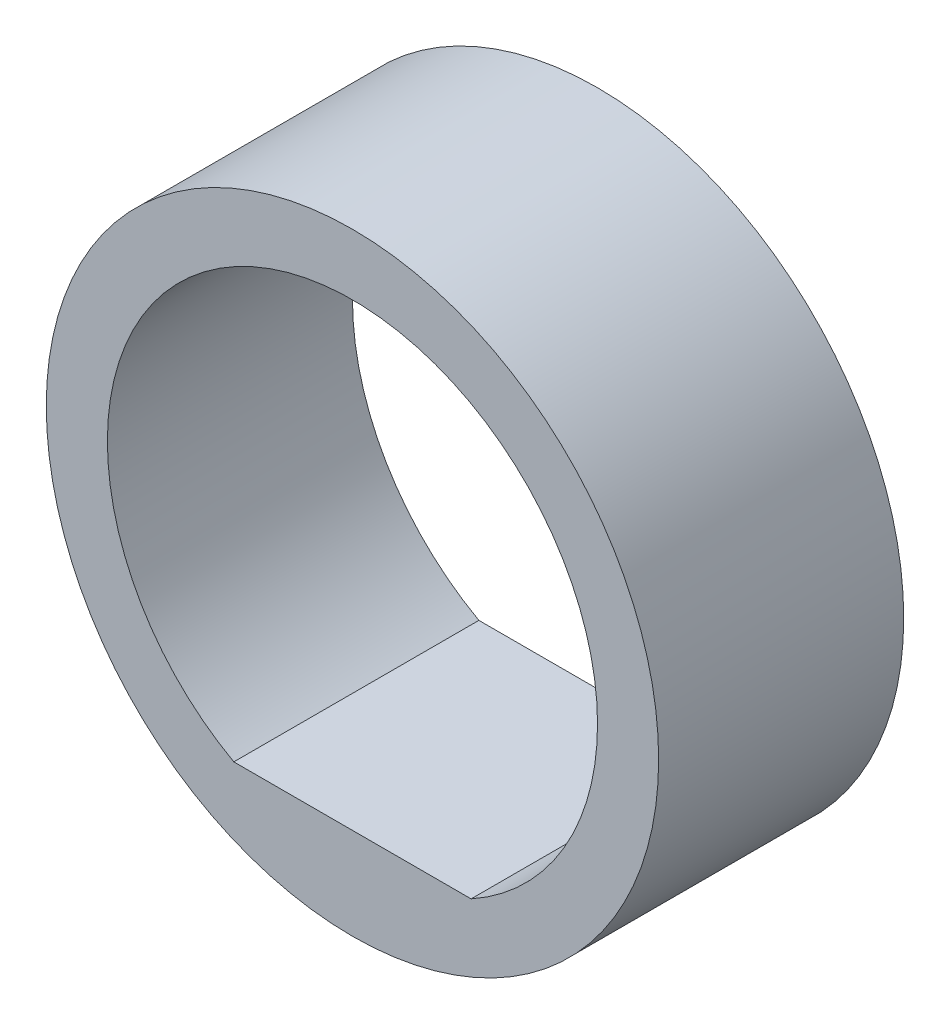
from build123d import *

# Parameters (mm, degrees)
SKETCH3_R           = 4.9975
BOSS_EXTRUDE1_DEPTH = 4


with BuildPart() as part:
    # Sketch3 → Boss-Extrude1 (new body)
    with BuildSketch(Plane.XY):
        with Locations((-111.133978708, 0)):
            Circle(SKETCH3_R)
        with BuildLine():
            Line((-111.133978708, -3.5), (-113.070470381, -3.5))
            ThreePointArc((-113.070470381, -3.5), (-111.133978708, 4), (-109.197487035, -3.5))
            Line((-109.197487035, -3.5), (-111.133978708, -3.5))
        make_face(mode=Mode.SUBTRACT)
    extrude(amount=BOSS_EXTRUDE1_DEPTH)


solid = part.part
